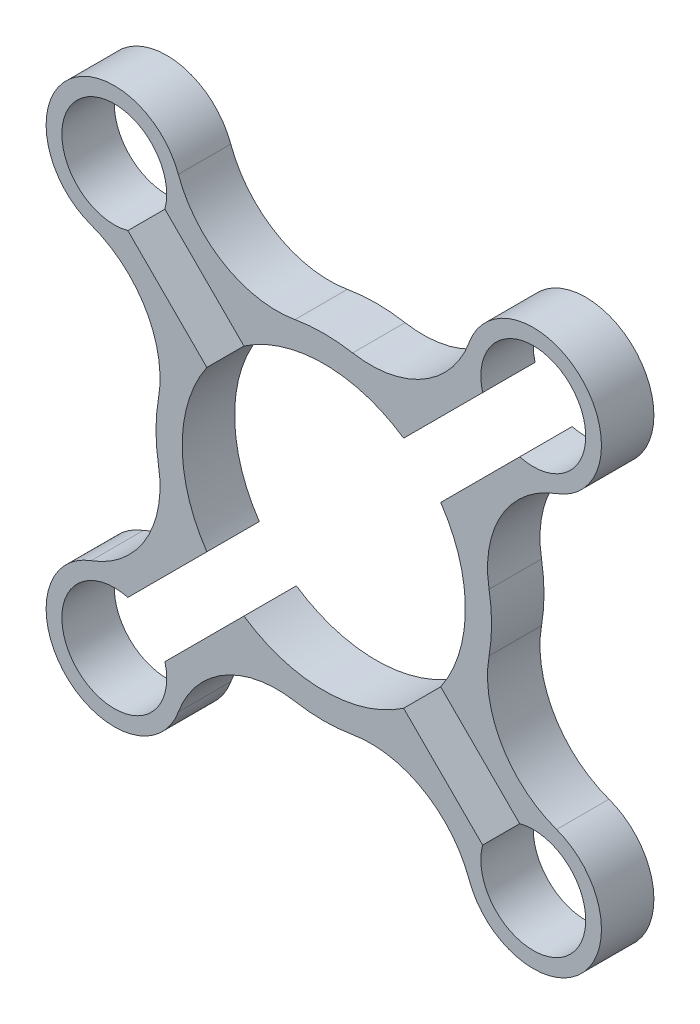
from build123d import *

# Parameters (mm, degrees)
BOSS_EXTRUDE1_DEPTH = 5


with BuildPart() as part:
    # Sketch1 → Boss-Extrude1 (new, symmetric)
    with BuildSketch(Plane.XY):
        with BuildLine():
            ThreePointArc((31.523820357, -5.499886369), (33.916662735, -18.956279365), (44.393071751, -27.733810979))
            ThreePointArc((44.393071751, -27.733810979), (49.143921292, -49.143921292), (27.733810979, -44.393071751))
            ThreePointArc((27.733810979, -44.393071751), (18.956279365, -33.916662735), (5.499886369, -31.523820357))
            ThreePointArc((5.499886369, -31.523820357), (0, -32), (-5.499886369, -31.523820357))
            ThreePointArc((-5.499886369, -31.523820357), (-18.956279365, -33.916662735), (-27.733810979, -44.393071751))
            ThreePointArc((-27.733810979, -44.393071751), (-49.143921292, -49.143921292), (-44.393071751, -27.733810979))
            ThreePointArc((-44.393071751, -27.733810979), (-33.916662735, -18.956279365), (-31.523820357, -5.499886369))
            ThreePointArc((-31.523820357, -5.499886369), (-32, 0), (-31.523820357, 5.499886369))
            ThreePointArc((-31.523820357, 5.499886369), (-33.916662735, 18.956279365), (-44.393071751, 27.733810979))
            ThreePointArc((-44.393071751, 27.733810979), (-49.143921292, 49.143921292), (-27.733810979, 44.393071751))
            ThreePointArc((-27.733810979, 44.393071751), (-18.956279365, 33.916662735), (-5.499886369, 31.523820357))
            ThreePointArc((-5.499886369, 31.523820357), (0, 32), (5.499886369, 31.523820357))
            ThreePointArc((5.499886369, 31.523820357), (18.956279365, 33.916662735), (27.733810979, 44.393071751))
            ThreePointArc((27.733810979, 44.393071751), (49.143921292, 49.143921292), (44.393071751, 27.733810979))
            ThreePointArc((44.393071751, 27.733810979), (33.916662735, 18.956279365), (31.523820357, 5.499886369))
            ThreePointArc((31.523820357, 5.499886369), (32, 0), (31.523820357, -5.499886369))
        make_face()
        with BuildLine():
            ThreePointArc((22.297196945, -15.226129133), (27, 0), (22.297196945, 15.226129133))
            Line((22.297196945, 15.226129133), (37.363342686, 30.292274874))
            ThreePointArc((37.363342686, 30.292274874), (47.022600949, 47.022600949), (30.292274874, 37.363342686))
            Line((30.292274874, 37.363342686), (15.226129133, 22.297196945))
            ThreePointArc((15.226129133, 22.297196945), (0, 27), (-15.226129133, 22.297196945))
            Line((-15.226129133, 22.297196945), (-30.292274874, 37.363342686))
            ThreePointArc((-30.292274874, 37.363342686), (-47.022600949, 47.022600949), (-37.363342686, 30.292274874))
            Line((-37.363342686, 30.292274874), (-22.297196945, 15.226129133))
            ThreePointArc((-22.297196945, 15.226129133), (-27, 0), (-22.297196945, -15.226129133))
            Line((-22.297196945, -15.226129133), (-37.363342686, -30.292274874))
            ThreePointArc((-37.363342686, -30.292274874), (-47.022600949, -47.022600949), (-30.292274874, -37.363342686))
            Line((-30.292274874, -37.363342686), (-15.226129133, -22.297196945))
            ThreePointArc((-15.226129133, -22.297196945), (0, -27), (15.226129133, -22.297196945))
            Line((15.226129133, -22.297196945), (30.292274874, -37.363342686))
            ThreePointArc((30.292274874, -37.363342686), (47.022600949, -47.022600949), (37.363342686, -30.292274874))
            Line((37.363342686, -30.292274874), (22.297196945, -15.226129133))
        make_face(mode=Mode.SUBTRACT)
    extrude(amount=BOSS_EXTRUDE1_DEPTH, both=True)


solid = part.part
